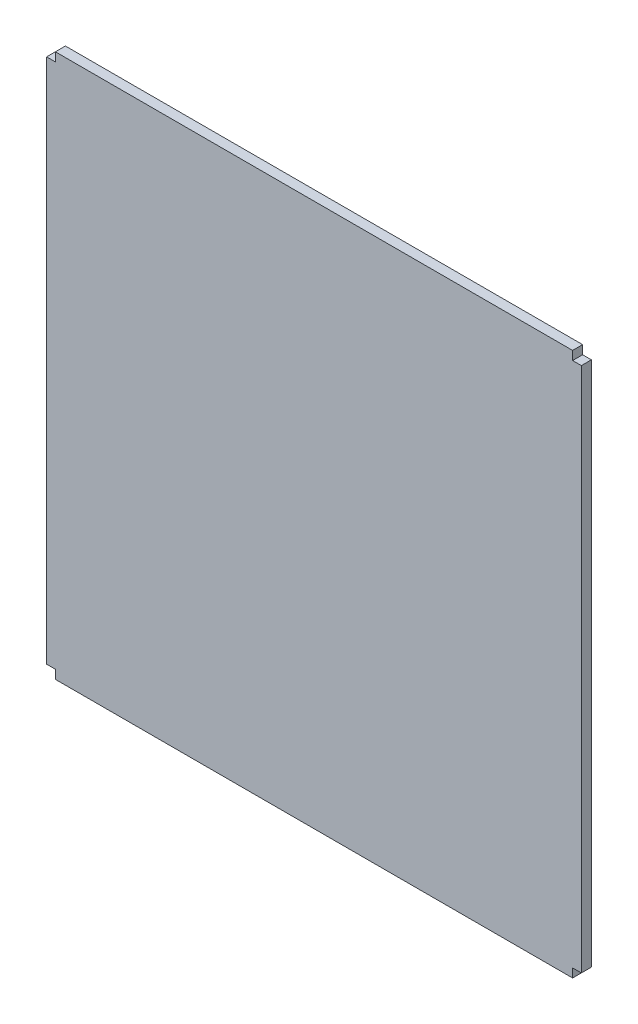
from build123d import *

# Parameters (mm, degrees)
SKETCH1_W               = 427
SKETCH1_H               = 434
BOSS_EXTRUDE1_DEPTH     = 8
SKETCH2_W               = 7
SKETCH2_H               = 7
CUT_EXTRUDE1_DEPTH      = 8
MIRROR2_COPY_1_SKETCH_W = 7
MIRROR2_COPY_1_SKETCH_H = 7
MIRROR2_COPY_1_DEPTH    = 8


with BuildPart() as part:
    # Sketch1 → Boss-Extrude1 (new body)
    with BuildSketch(Plane.XY):
        Rectangle(SKETCH1_W, SKETCH1_H)
    extrude(amount=BOSS_EXTRUDE1_DEPTH)

    # Sketch2 → Cut-Extrude1 (cut)
    with BuildSketch(Plane.XY.offset(8)):
        with Locations((-210, 213.5)):
            Rectangle(SKETCH2_W, SKETCH2_H)
    cut_extrude1 = extrude(amount=-CUT_EXTRUDE1_DEPTH, mode=Mode.SUBTRACT)

    # Mirror1: Cut-Extrude1 across plane
    add(cut_extrude1.mirror(Plane(origin=(0, 0, 0), x_dir=(0, 0, 1), z_dir=(1, 0, 0))), mode=Mode.SUBTRACT)

    # Mirror2: Cut-Extrude1 across plane
    add(cut_extrude1.mirror(Plane.ZX), mode=Mode.SUBTRACT)

    # Mirror2 copy 1 sketch → Mirror2 copy 1 (cut)
    with BuildSketch(Plane(origin=(0, 0, 8), x_dir=(-1, 0, 0), z_dir=(0, 0, 1))):
        with Locations((-210, 213.5)):
            Rectangle(MIRROR2_COPY_1_SKETCH_W, MIRROR2_COPY_1_SKETCH_H)
    extrude(amount=-MIRROR2_COPY_1_DEPTH, mode=Mode.SUBTRACT)


solid = part.part
